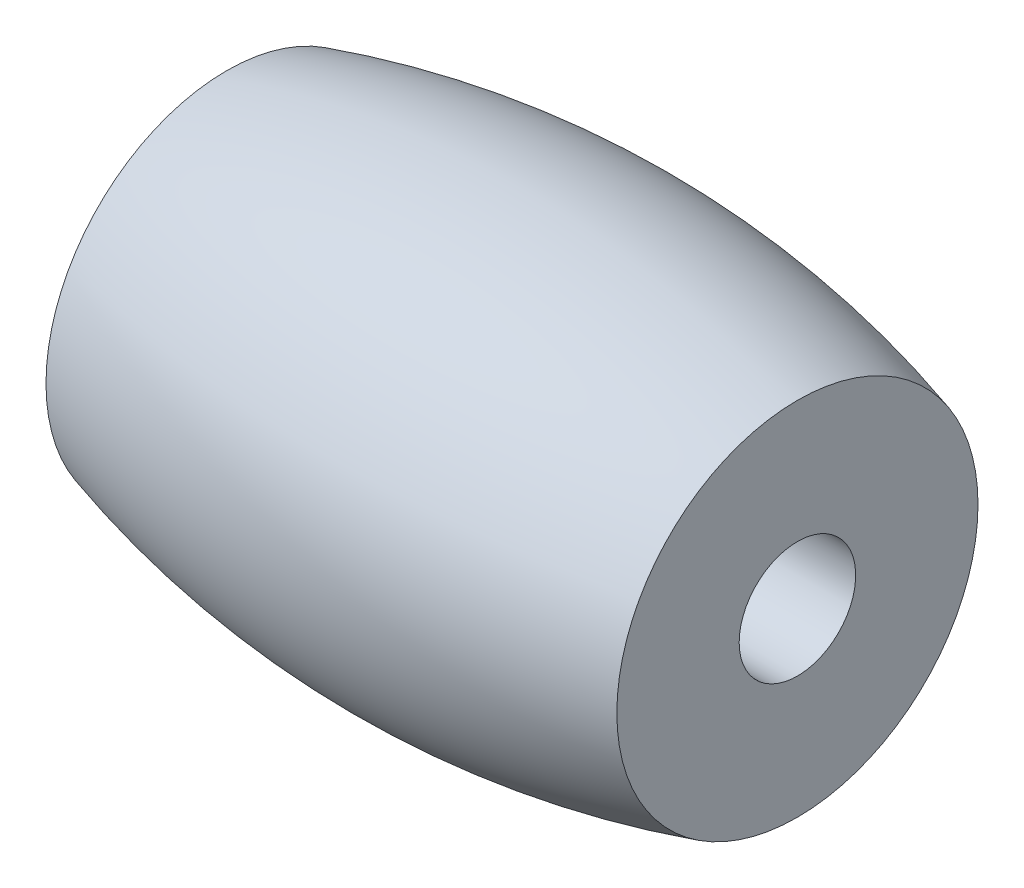
from build123d import *

# Parameters (mm, degrees)
CROQUIS1_W              = 24.5
CROQUIS1_H              = 19
SALIENTE_EXTRUIR1_DEPTH = 19
CROQUIS4_R              = 2.5
CORTAR_EXTRUIR1_DEPTH   = 34.5


with BuildPart() as part:
    # Croquis1 → Saliente-Extruir1 (new body)
    with BuildSketch(Plane(origin=(0, 0, 0), x_dir=(1, 0, 0), z_dir=(0, 1, 0))):
        Rectangle(CROQUIS1_W, CROQUIS1_H)
    extrude(amount=SALIENTE_EXTRUIR1_DEPTH)

    # Croquis2 → Cortar-Revolución2 (revolve, cut)
    with BuildSketch(Plane(origin=(0, 9.5, 0), x_dir=(1, 0, 0), z_dir=(0, 1, 0)), mode=Mode.PRIVATE) as cortar_revoluci_n2_sk:
        with BuildLine():
            Line((-12.25, 7.75), (-12.25, 18.221479362))
            Line((-12.25, 18.221479362), (12.25, 18.221479362))
            Line((12.25, 18.221479362), (12.25, 7.75))
            ThreePointArc((12.25, 7.75), (0, 9.5), (-12.25, 7.75))
        make_face()
    revolve(cortar_revoluci_n2_sk.sketch.rotate(Axis((-13.475, 9.5, 0), (1, 0, 0)), 180), axis=Axis((-13.475, 9.5, 0), (1, 0, 0)), mode=Mode.SUBTRACT)

    # Croquis4 → Cortar-Extruir1 (cut)
    with BuildSketch(Plane.ZY.offset(12.25)):
        with Locations((0, 9.5)):
            Circle(CROQUIS4_R)
    extrude(amount=-CORTAR_EXTRUIR1_DEPTH, mode=Mode.SUBTRACT)


solid = part.part
